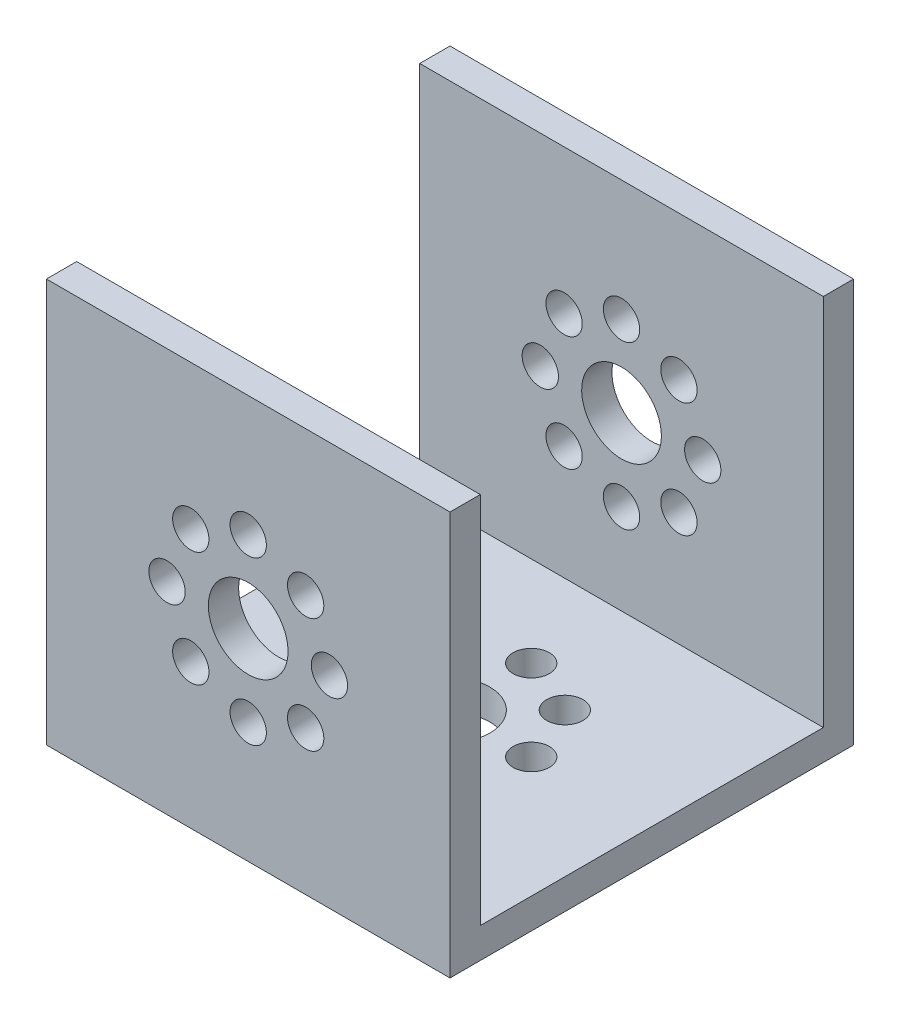
from build123d import *

# Parameters (mm, degrees)
C_1U_DEPTH               = 20
SKETCH_8_R               = 3.95
SKETCH_8_R_2             = 1.8
CUT_EXTRUDE_696_DEPTH    = 5
PATTERN_CIRCULAR_A_COUNT = 2
PATTERN_CIRCULAR_A_ANGLE = 270
PATTERN_CIRCULAR_B_COUNT = 2
PATTERN_CIRCULAR_B_ANGLE = 90


with BuildPart() as part:
    # c型梁 → C型梁1u (new, symmetric)
    with BuildSketch(Plane(origin=(0, 0, 0), x_dir=(0, 0, -1), z_dir=(1, 0, 0))):
        Polygon((-20, 0), (20, 0), (20, 40), (17, 40), (17, 3), (-17, 3), (-17, 40), (-20, 40), align=None)
    extrude(amount=C_1U_DEPTH, both=True)

    # 8位安装孔 → Cut-Extrude 696 (cut, symmetric)
    with BuildSketch(Plane(origin=(0, 3, 0), x_dir=(1, 0, 0), z_dir=(0, 1, 0))):
        with Locations(Location((0, 0, 0), (0, 0, 270))):
            Circle(SKETCH_8_R)
        with Locations(Location((8.05, 0, 0), (0, 0, 270))):
            Circle(SKETCH_8_R_2)
        with Locations(Location((5.692209589, -5.692209589, 0), (0, 0, 270))):
            Circle(SKETCH_8_R_2)
        with Locations(Location((0, -8.05, 0), (0, 0, 270))):
            Circle(SKETCH_8_R_2)
        with Locations(Location((-5.692209589, -5.692209589, 0), (0, 0, 270))):
            Circle(SKETCH_8_R_2)
        with Locations(Location((-8.05, 0, 0), (0, 0, 270))):
            Circle(SKETCH_8_R_2)
        with Locations(Location((-5.692209589, 5.692209589, 0), (0, 0, 270))):
            Circle(SKETCH_8_R_2)
        with Locations(Location((0, 8.05, 0), (0, 0, 270))):
            Circle(SKETCH_8_R_2)
        with Locations(Location((5.692209589, 5.692209589, 0), (0, 0, 270))):
            Circle(SKETCH_8_R_2)
    cut_extrude_696 = extrude(amount=CUT_EXTRUDE_696_DEPTH, both=True, mode=Mode.SUBTRACT)

    # 安装孔A侧: Cut-Extrude 696 ×2 about axis
    pattern_circular_a_axis = Axis((20, 3, 17), (-1, 0, 0))
    for i in range(1, PATTERN_CIRCULAR_A_COUNT):
        add(cut_extrude_696.rotate(pattern_circular_a_axis, i * PATTERN_CIRCULAR_A_ANGLE / (PATTERN_CIRCULAR_A_COUNT - 1)), mode=Mode.SUBTRACT)

    # 安装孔B侧: Cut-Extrude 696 ×2 about axis
    pattern_circular_b_axis = Axis((20, 3, -17), (-1, 0, 0))
    for i in range(1, PATTERN_CIRCULAR_B_COUNT):
        add(cut_extrude_696.rotate(pattern_circular_b_axis, i * PATTERN_CIRCULAR_B_ANGLE / (PATTERN_CIRCULAR_B_COUNT - 1)), mode=Mode.SUBTRACT)


solid = part.part
